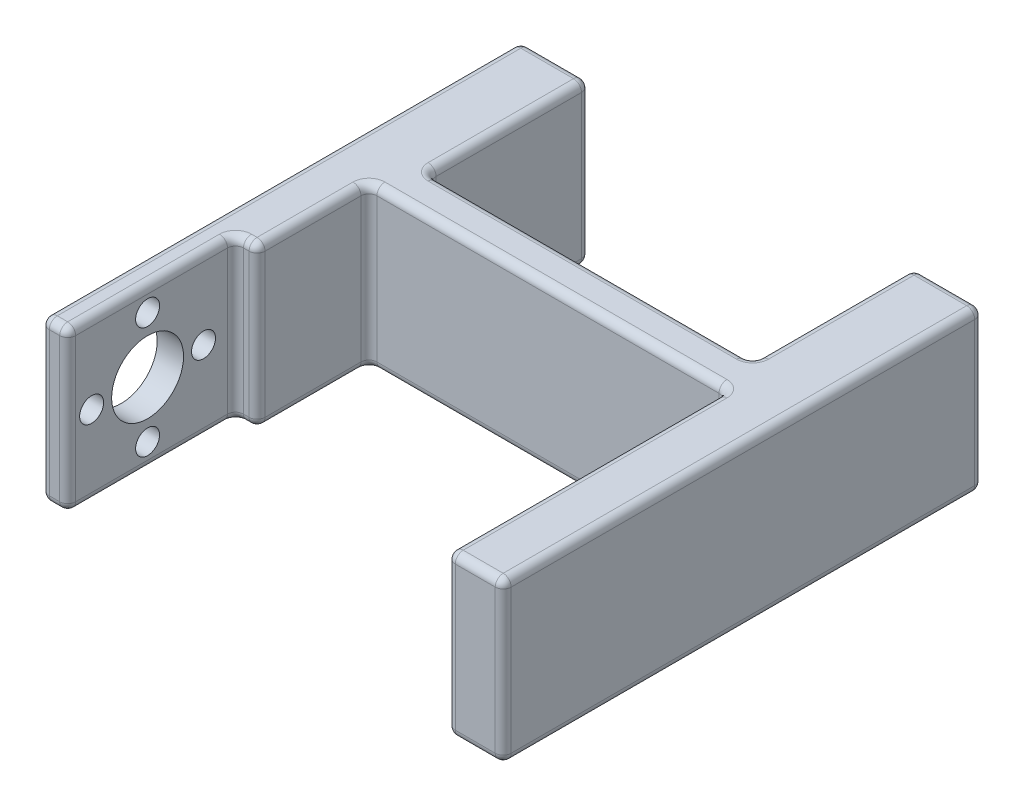
from build123d import *

# Parameters (mm, degrees)
BOSS_EXTRUDE1_DEPTH = 20
SKETCH4_R           = 1.5
SKETCH4_R_2         = 4.5
CUT_EXTRUDE1_DEPTH  = 10
CUT_EXTRUDE3_START  = -3.3
SKETCH8_W           = 21
SKETCH8_H           = 20
CUT_EXTRUDE3_DEPTH  = 2.7
FILLET1_R           = 1
CUT_EXTRUDE2_START  = -20
SKETCH6_R           = 1
CUT_EXTRUDE2_DEPTH  = 6.7
SKETCH3_R           = 8.1
CUT_EXTRUDE4_DEPTH  = 5


with BuildPart() as part:
    # Sketch1 → Boss-Extrude1 (new body)
    with BuildSketch(Plane(origin=(0, 0, 0), x_dir=(1, 0, 0), z_dir=(0, 1, 0))):
        Polygon((0, 0), (0, -60), (6, -60), (6, -25), (50.8, -25), (50.8, -60), (57.8, -60), (57.8, 0), (49.2, 0), (49.2, -20.2), (8.6, -20.2), (8.6, 0), align=None)
    extrude(amount=BOSS_EXTRUDE1_DEPTH)

    # Sketch4 → Cut-Extrude1 (cut)
    with BuildSketch(Plane.ZY):
        with Locations((50, 17)):
            Circle(SKETCH4_R)
        with Locations((57, 10)):
            Circle(SKETCH4_R)
        with Locations((50, 3)):
            Circle(SKETCH4_R)
        with Locations((43, 10)):
            Circle(SKETCH4_R)
        with Locations((50, 10)):
            Circle(SKETCH4_R_2)
    extrude(amount=-CUT_EXTRUDE1_DEPTH, mode=Mode.SUBTRACT)

    # Sketch8 → Cut-Extrude3 (cut)
    with BuildSketch(Plane.ZY.offset(CUT_EXTRUDE3_START)):
        with Locations((49.5, 10)):
            Rectangle(SKETCH8_W, SKETCH8_H)
    extrude(amount=-CUT_EXTRUDE3_DEPTH, mode=Mode.SUBTRACT)

    # Fillet1
    fillet1_edges = [part.edges().sort_by_distance(p)[0] for p in [
        (8.6, 0, 10.1),
        (28.9, 0, 20.2),
        (1.65, 20, 60),
        (49.2, 0, 10.1),
        (53.5, 0, 0),
        (57.8, 0, 30),
        (54.3, 0, 60),
        (50.8, 0, 42.5),
        (28.4, 0, 25),
        (1.65, 0, 60),
        (0, 0, 30),
        (4.3, 0, 0),
        (8.6, 10, 0),
        (8.6, 10, 20.2),
        (49.2, 10, 20.2),
        (28.4, 20, 25),
        (49.2, 10, 0),
        (57.8, 10, 0),
        (57.8, 10, 60),
        (50.8, 10, 60),
        (50.8, 10, 25),
        (6, 10, 25),
        (0, 10, 60),
        (0, 10, 0),
        (50.8, 20, 42.5),
        (54.3, 20, 60),
        (57.8, 20, 30),
        (53.5, 20, 0),
        (49.2, 20, 10.1),
        (28.9, 20, 20.2),
        (8.6, 20, 10.1),
        (4.3, 20, 0),
        (6, 0, 32),
        (6, 20, 32),
        (3.3, 10, 39),
        (3.3, 0, 49.5),
        (3.3, 10, 60),
        (3.3, 20, 49.5),
        (6, 10, 39),
        (4.65, 0, 39),
        (4.65, 20, 39),
        (0, 20, 30),
    ]]
    fillet(fillet1_edges, radius=FILLET1_R)

    # Sketch6 → Cut-Extrude2 (cut)
    with BuildSketch(Plane(origin=(0, 20, 0), x_dir=(1, 0, 0), z_dir=(0, 1, 0)).offset(CUT_EXTRUDE2_START)):
        with Locations(Location((4.25, -4, 0), (0, 0, 270))):
            Circle(SKETCH6_R)
        with Locations(Location((4.25, -14, 0), (0, 0, 270))):
            Circle(SKETCH6_R)
        with Locations(Location((52.55, -14, 0), (0, 0, 270))):
            Circle(SKETCH6_R)
        with Locations(Location((52.55, -4, 0), (0, 0, 270))):
            Circle(SKETCH6_R)
    extrude(amount=CUT_EXTRUDE2_DEPTH, mode=Mode.SUBTRACT)

    # Sketch3 → Cut-Extrude4 (cut)
    with BuildSketch(Plane.ZY.offset(-50.8)):
        with Locations((50, 10)):
            Circle(SKETCH3_R)
    extrude(amount=-CUT_EXTRUDE4_DEPTH, mode=Mode.SUBTRACT)


solid = part.part
